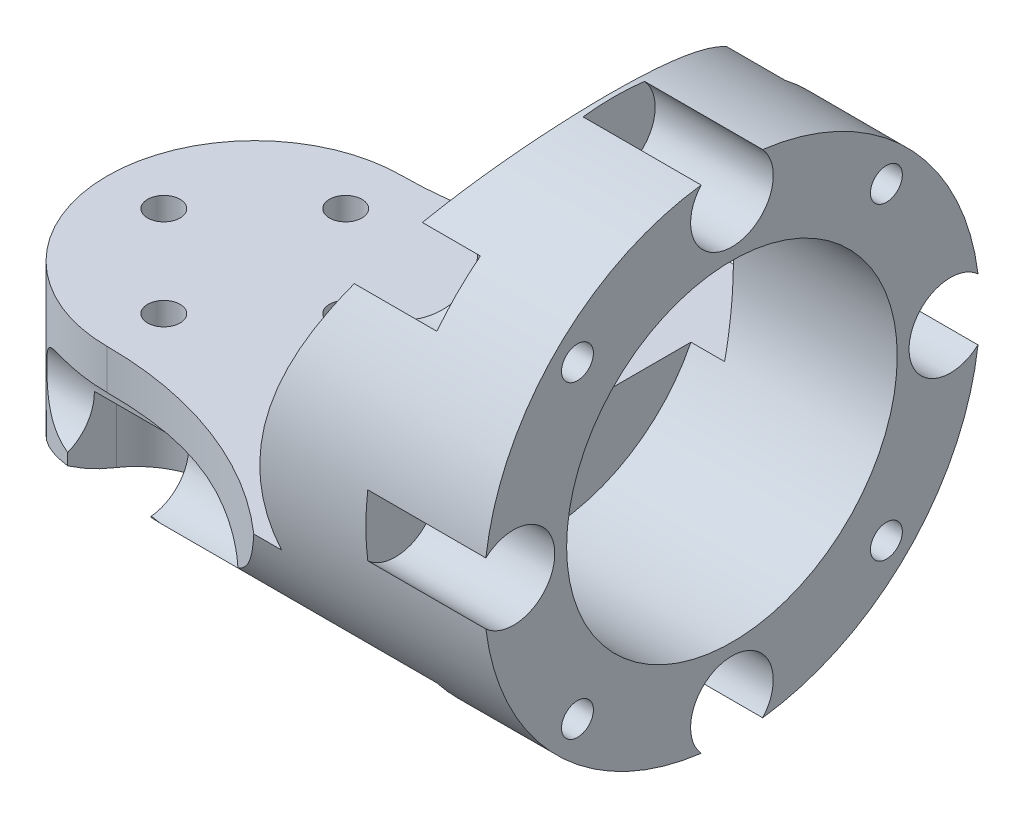
from build123d import *
from build123d.topology import SkipClean

# Parameters (mm, degrees)
SKETCH1_R                = 12.5
SKETCH1_R_2              = 1.375
BOSS_EXTRUDE1_DEPTH      = 10
BOSS_EXTRUDE2_START      = -20
BOSS_EXTRUDE2_DEPTH      = 20
BOSS_EXTRUDE3_DEPTH      = 21
BOSS_EXTRUDE3_DEPTH_BACK = 45
BOSS_EXTRUDE4_START      = 10
SKETCH12_R               = 1.375
BOSS_EXTRUDE4_DEPTH      = 10
SKETCH4_R                = 128.83411214
SKETCH4_R_2              = 21
CUT_EXTRUDE1_DEPTH       = 61
SKETCH5_R                = 14
CUT_EXTRUDE2_DEPTH       = 16
SKETCH6_R                = 1.35
CUT_EXTRUDE3_DEPTH       = 69.028433942
SKETCH8_R                = 3.5
CUT_EXTRUDE4_DEPTH       = 10
CIRPATTERN1_COUNT        = 4
SKETCH9_R                = 3.5
CUT_EXTRUDE5_DEPTH       = 47
CUT_EXTRUDE8_DEPTH       = 8
CIRPATTERN3_COUNT        = 3
CIRPATTERN3_ANGLE        = 180
SKETCH14_R               = 4
CUT_EXTRUDE9_DEPTH       = 8


with BuildPart() as part:
    # Sketch1 → Boss-Extrude1 (new body)
    with BuildSketch(Plane(origin=(0, 0, 0), x_dir=(1, 0, 0), z_dir=(0, 1, 0))):
        with Locations(Location((0, 0, 0), (0, 0, 270))):
            Circle(SKETCH1_R)
        with Locations(Location((-7.7, 0, 0), (0, 0, 270))):
            Circle(SKETCH1_R_2, mode=Mode.SUBTRACT)
        with Locations(Location((0, 7.7, 0), (0, 0, 270))):
            Circle(SKETCH1_R_2, mode=Mode.SUBTRACT)
        with Locations(Location((7.7, 0, 0), (0, 0, 270))):
            Circle(SKETCH1_R_2, mode=Mode.SUBTRACT)
        with Locations(Location((0, -7.7, 0), (0, 0, 270))):
            Circle(SKETCH1_R_2, mode=Mode.SUBTRACT)
    extrude(amount=BOSS_EXTRUDE1_DEPTH)

    # Sketch2 → Boss-Extrude2 (add)
    with BuildSketch(Plane(origin=(0, 10, 0), x_dir=(1, 0, 0), z_dir=(0, 1, 0)).offset(BOSS_EXTRUDE2_START)):
        with BuildLine():
            Line((23.126729335, 23.288716048), (40.408461538, 23.288716048))
            Line((40.408461538, 23.288716048), (40.408461538, -23.288716048))
            Line((40.408461538, -23.288716048), (23.126729335, -23.288716048))
            ThreePointArc((23.126729335, -23.288716048), (12.75972182, -15.329842661), (0, -12.5))
            ThreePointArc((0, -12.5), (12.5, 0), (0, 12.5))
            ThreePointArc((0, 12.5), (12.75972182, 15.329842661), (23.126729335, 23.288716048))
        make_face()
    extrude(amount=BOSS_EXTRUDE2_DEPTH)

    # Sketch3 → Boss-Extrude3 (add, two sides: drawn at the far end of the back side and taken through both)
    with BuildSketch(Plane.XZ.offset(-BOSS_EXTRUDE3_DEPTH_BACK)):
        with BuildLine():
            Line((23.126729335, -23.288716048), (40.408461538, -23.288716048))
            Line((40.408461538, -23.288716048), (40.408461538, 23.288716048))
            Line((40.408461538, 23.288716048), (23.126729335, 23.288716048))
            ThreePointArc((23.126729335, 23.288716048), (22.194470353, 22.228360976), (21.213641499, 21.212765363))
            ThreePointArc((21.213641499, 21.212765363), (30, 0), (21.213641499, -21.212765363))
            ThreePointArc((21.213641499, -21.212765363), (22.194470353, -22.228360976), (23.126729335, -23.288716048))
        make_face()
    extrude(amount=BOSS_EXTRUDE3_DEPTH + BOSS_EXTRUDE3_DEPTH_BACK)

    # Sketch12 → Boss-Extrude4 (add)
    with SkipClean():  # the faces are left unmerged after this step: merging them gives an invalid solid
        with BuildSketch(Plane.XZ.offset(BOSS_EXTRUDE4_START)):
            with BuildLine():
                ThreePointArc((0, -12.5), (12.5, 0), (0, 12.5))
                ThreePointArc((0, 12.5), (-12.5, 0), (0, -12.5))
            make_face()
            with Locations(Location((0, 7.7, 0), (0, 0, 270))):
                Circle(SKETCH12_R, mode=Mode.SUBTRACT)
            with Locations(Location((7.7, 0, 0), (0, 0, 270))):
                Circle(SKETCH12_R, mode=Mode.SUBTRACT)
            with Locations(Location((0, -7.7, 0), (0, 0, 270))):
                Circle(SKETCH12_R, mode=Mode.SUBTRACT)
            with Locations(Location((-7.7, 0, 0), (0, 0, 270))):
                Circle(SKETCH12_R, mode=Mode.SUBTRACT)
        extrude(amount=-BOSS_EXTRUDE4_DEPTH)

    # Sketch4 → Cut-Extrude1 (cut)
    with SkipClean():  # the faces are left unmerged after this step: merging them gives an invalid solid
        with BuildSketch(Plane(origin=(40.408461538, 0, 0), x_dir=(0, 0, -1), z_dir=(1, 0, 0))):
            with Locations((0, 16.25)):
                Circle(SKETCH4_R)
            with Locations((0, 16.25)):
                Circle(SKETCH4_R_2, mode=Mode.SUBTRACT)
        extrude(amount=-CUT_EXTRUDE1_DEPTH, mode=Mode.SUBTRACT)

    # Sketch5 → Cut-Extrude2 (cut)
    with SkipClean():  # the faces are left unmerged after this step: merging them gives an invalid solid
        with BuildSketch(Plane(origin=(40.408461538, 0, 0), x_dir=(0, 0, -1), z_dir=(1, 0, 0))):
            with Locations((0, 16.25)):
                Circle(SKETCH5_R)
        extrude(amount=-CUT_EXTRUDE2_DEPTH, mode=Mode.SUBTRACT)

    # Sketch6 → Cut-Extrude3 (cut, through all)
    with SkipClean():  # the faces are left unmerged after this step: merging them gives an invalid solid
        with BuildSketch(Plane(origin=(40.408461538, 0, 0), x_dir=(0, 0, -1), z_dir=(1, 0, 0))):
            with Locations((13.081475452, 29.331475452)):
                Circle(SKETCH6_R)
            with Locations((13.081475452, 3.168524548)):
                Circle(SKETCH6_R)
            with Locations((-13.081475452, 3.168524548)):
                Circle(SKETCH6_R)
            with Locations((-13.081475452, 29.331475452)):
                Circle(SKETCH6_R)
        extrude(amount=-CUT_EXTRUDE3_DEPTH, mode=Mode.SUBTRACT)

    # Sketch8 → Cut-Extrude4 (cut)
    with SkipClean():  # the faces are left unmerged after this step: merging them gives an invalid solid
        with BuildSketch(Plane(origin=(40.408461538, 0, 0), x_dir=(0, 0, -1), z_dir=(1, 0, 0))):
            with Locations((18.5, 16.25)):
                Circle(SKETCH8_R)
        cut_extrude4 = extrude(amount=-CUT_EXTRUDE4_DEPTH, mode=Mode.SUBTRACT)

    # CirPattern1: Cut-Extrude4 ×4 about axis
    with SkipClean():  # the faces are left unmerged after this step: merging them gives an invalid solid
        cirpattern1_axis = Axis((0, 16.25, 0), (1, 0, 0))
        for i in range(1, CIRPATTERN1_COUNT):
            add(cut_extrude4.rotate(cirpattern1_axis, i * 360 / CIRPATTERN1_COUNT), mode=Mode.SUBTRACT)

    # Sketch9 → Cut-Extrude5 (cut)
    with SkipClean():  # the faces are left unmerged after this step: merging them gives an invalid solid
        with BuildSketch(Plane(origin=(-15, 0, 0), x_dir=(0, 0, -1), z_dir=(1, 0, 0))):
            with Locations((13.081475452, 29.331475452)):
                Circle(SKETCH9_R)
            with Locations((-13.081475452, 3.168524548)):
                Circle(SKETCH9_R)
            with Locations((-13.081475452, 29.331475452)):
                Circle(SKETCH9_R)
            with Locations((13.081475452, 3.168524548)):
                Circle(SKETCH9_R)
        extrude(amount=CUT_EXTRUDE5_DEPTH, mode=Mode.SUBTRACT)

    # Sketch13 → Cut-Extrude8 (cut)
    with SkipClean():  # the faces are left unmerged after this step: merging them gives an invalid solid
        with BuildSketch(Plane(origin=(0, -4.75, 0), x_dir=(-1, 0, 0), z_dir=(0, -1, 0))):
            with BuildLine():
                Line((-4, 7.7), (-4, 15.339898774))
                Line((-4, 15.339898774), (4, 15.339898774))
                Line((4, 15.339898774), (4, 7.7))
                ThreePointArc((4, 7.7), (0, 3.7), (-4, 7.7))
            make_face()
        cut_extrude8 = extrude(amount=-CUT_EXTRUDE8_DEPTH, mode=Mode.SUBTRACT)

    # CirPattern3: Cut-Extrude8 ×3 about axis
    with SkipClean():  # the faces are left unmerged after this step: merging them gives an invalid solid
        cirpattern3_axis = Axis((0, 0, 0), (0, 1, 0))
        for i in range(1, CIRPATTERN3_COUNT):
            add(cut_extrude8.rotate(cirpattern3_axis, i * CIRPATTERN3_ANGLE / (CIRPATTERN3_COUNT - 1)), mode=Mode.SUBTRACT)

    # Sketch14 → Cut-Extrude9 (cut)
    with SkipClean():  # the faces are left unmerged after this step: merging them gives an invalid solid
        with BuildSketch(Plane(origin=(0, -4.75, 0), x_dir=(-1, 0, 0), z_dir=(0, -1, 0))):
            with Locations(Location((-7.7, 0, 0), (0, 0, 90))):
                Circle(SKETCH14_R)
        extrude(amount=-CUT_EXTRUDE9_DEPTH, mode=Mode.SUBTRACT)


solid = part.part
